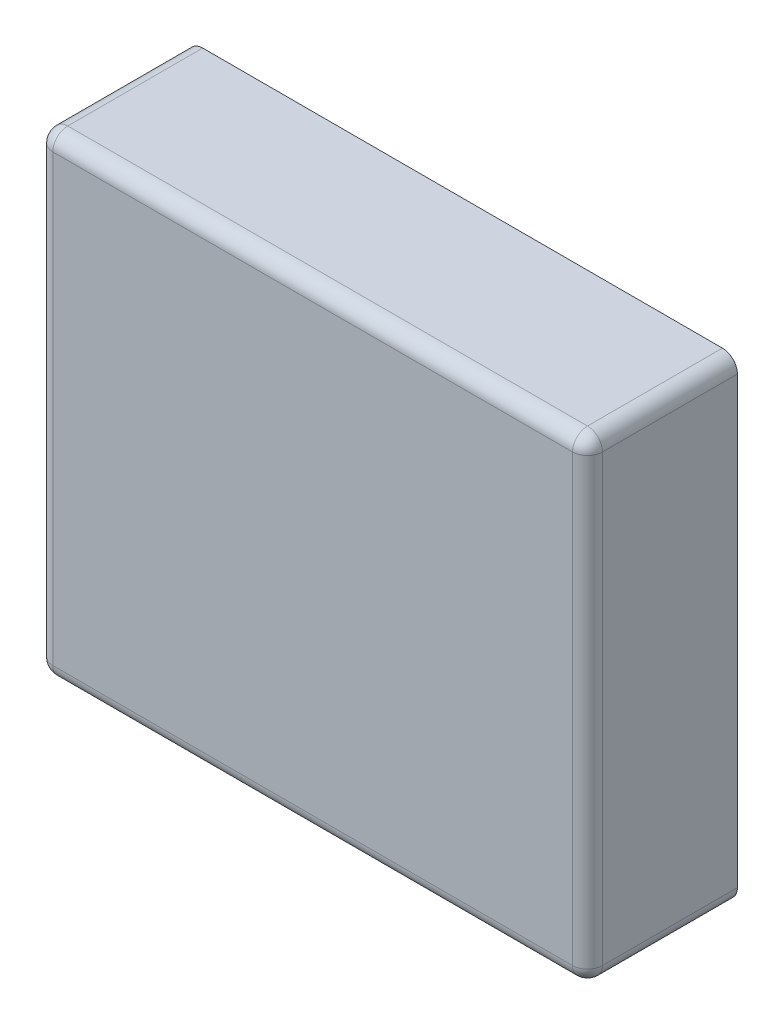
from build123d import *

# Parameters (mm, degrees)
SKETCH2_W           = 110
SKETCH2_H           = 95
BOSS_EXTRUDE2_DEPTH = 30
FILLET3_R           = 3
SHELL1_T            = -1


with BuildPart() as part:
    # Sketch2 → Boss-Extrude2 (new body)
    with BuildSketch(Plane.XY):
        with Locations((0.005889282, -16.99352179)):
            Rectangle(SKETCH2_W, SKETCH2_H)
    extrude(amount=BOSS_EXTRUDE2_DEPTH)

    # Fillet3
    fillet3_edges = [part.edges().sort_by_distance(p)[0] for p in [
        (55.005889282, -16.99352179, 30),
        (0.005889282, 30.50647821, 30),
        (-54.994110718, -16.99352179, 30),
        (-54.994110718, 30.50647821, 15),
        (55.005889282, 30.50647821, 15),
        (55.005889282, -64.49352179, 15),
        (-54.994110718, -64.49352179, 15),
        (0.005889282, -64.49352179, 30),
    ]]
    fillet(fillet3_edges, radius=FILLET3_R)

    # Shell1
    shell1_openings = [part.faces().sort_by_distance(p)[0] for p in [
        (0.005889282, -16.99352179, 0),
    ]]
    offset(amount=SHELL1_T, openings=shell1_openings, kind=Kind.INTERSECTION)


solid = part.part
